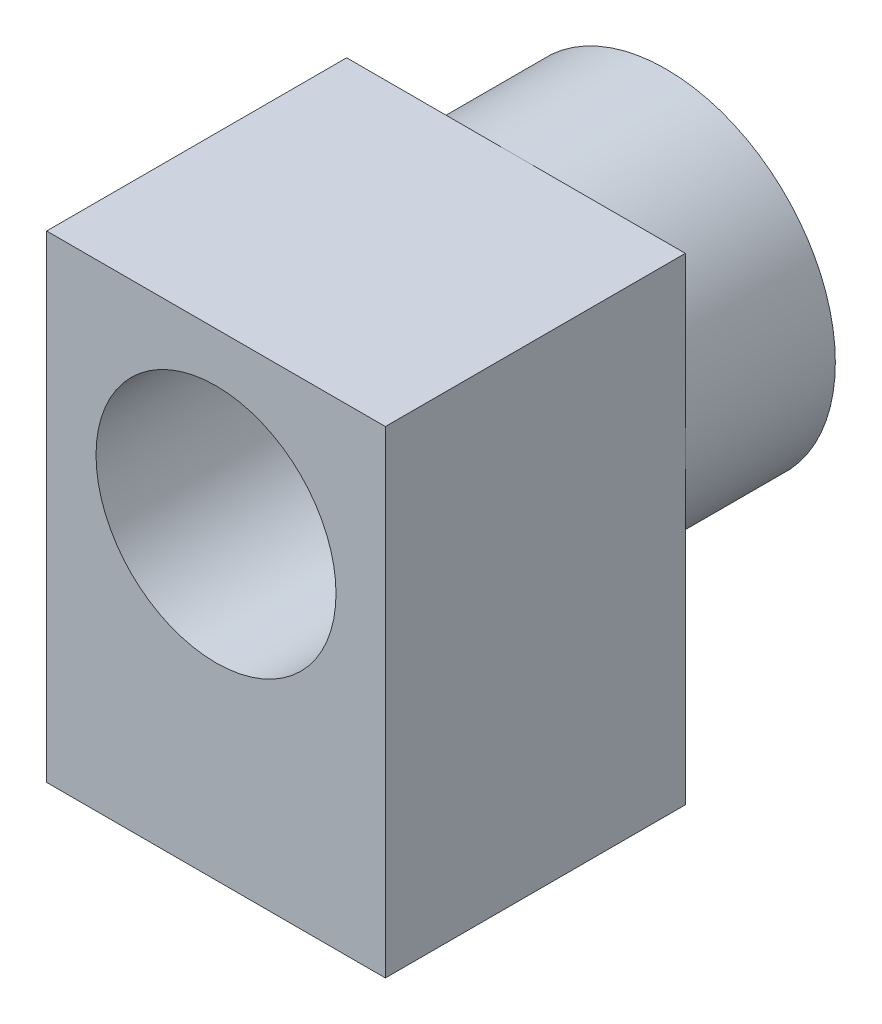
from build123d import *

# Parameters (mm, degrees)
SKETCH1_R           = 11.291730028
SKETCH1_R_2         = 8
BOSS_EXTRUDE1_DEPTH = 10
SKETCH2_W           = 22.583460056
SKETCH2_H           = 31.840111269
BOSS_EXTRUDE2_DEPTH = 20
CUT_EXTRUDE1_REACH  = 40.075
SKETCH3_R           = 8


with BuildPart() as part:
    # Sketch1 → Boss-Extrude1 (new body)
    with BuildSketch(Plane.XY):
        Circle(SKETCH1_R)
        Circle(SKETCH1_R_2, mode=Mode.SUBTRACT)
    extrude(amount=BOSS_EXTRUDE1_DEPTH)

    # Sketch2 → Boss-Extrude2 (add)
    with BuildSketch(Plane.XY.offset(10)):
        with Locations((0, -4.628325607)):
            Rectangle(SKETCH2_W, SKETCH2_H)
    extrude(amount=BOSS_EXTRUDE2_DEPTH)

    # Sketch3 → Cut-Extrude1 (cut, up to next)
    with BuildSketch(Plane.XY.offset(30), mode=Mode.PRIVATE) as cut_extrude1_sk1:
        Circle(SKETCH3_R)
    cut_extrude1_tool1 = extrude(cut_extrude1_sk1.sketch, amount=-CUT_EXTRUDE1_REACH, mode=Mode.PRIVATE) & part.part
    add(cut_extrude1_tool1.solids().sort_by_distance((0, 0, 30))[0], mode=Mode.SUBTRACT)


solid = part.part
